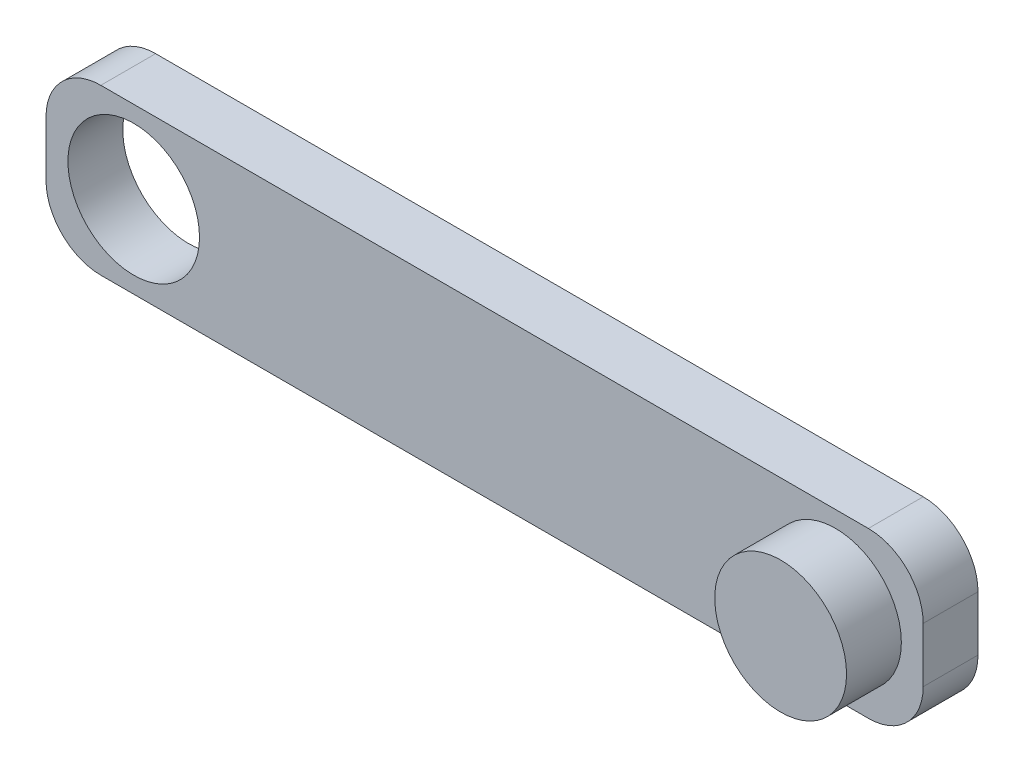
from build123d import *

# Parameters (mm, degrees)
SKETCH_1_R      = 6.010671136
SKETCH_1_R_2    = 6
EXTRUDE_1_DEPTH = 5
SKETCH_1_3_R    = 6.010671136
EXTRUDE_2_DEPTH = 10


with BuildPart() as part:
    # 草图1 → 凸台-拉伸1 (new body)
    with BuildSketch(Plane.XY):
        with BuildLine():
            Line((75, 15), (5, 15))
            ThreePointArc((5, 15), (1.464466094, 13.535533906), (0, 10))
            Line((0, 10), (0, 5))
            ThreePointArc((0, 5), (1.464466094, 1.464466094), (5, 0))
            Line((5, 0), (75, 0))
            ThreePointArc((75, 0), (78.535533906, 1.464466094), (80, 5))
            Line((80, 5), (80, 10))
            ThreePointArc((80, 10), (78.535533906, 13.535533906), (75, 15))
        make_face()
        with Locations((72, 7.5)):
            Circle(SKETCH_1_R, mode=Mode.SUBTRACT)
        with Locations((8, 7.5)):
            Circle(SKETCH_1_R_2, mode=Mode.SUBTRACT)
    extrude(amount=EXTRUDE_1_DEPTH)

    # 草图1<3> → 凸台-拉伸2 (add)
    with BuildSketch(Plane.XY):
        with Locations((72, 7.5)):
            Circle(SKETCH_1_3_R)
    extrude(amount=EXTRUDE_2_DEPTH)


solid = part.part
